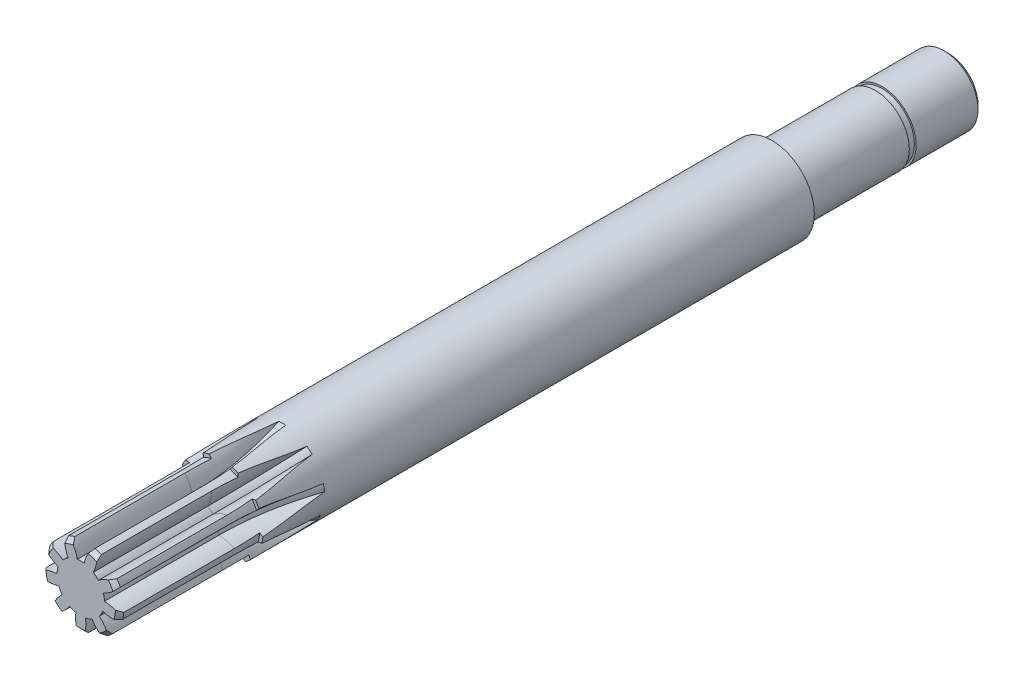
from build123d import *

# Parameters (mm, degrees)
R_P_TITION_CIRCULAIRE1_COUNT = 9


with BuildPart() as part:
    # Esquisse1 → Révolution1 (revolve)
    with BuildSketch(Plane(origin=(0, 0, 0), x_dir=(0, 0, -1), z_dir=(1, 0, 0))):
        Polygon((0, 5), (0, 4), (12.2, 4), (12.2, 3.8), (13, 3.8), (13, 4), (20.3, 4), (20.8, 3.5), (20.8, 0), (-81.5, 0), (-81.5, 4.1), (-81, 4.6), (-65, 4.6), (-65, 5), align=None)
    revolve(axis=Axis((0, 0, 153.012761233), (0, 0, -1)))

    # Enlèvement de matière-Balayage1: sweep along a path in Esquisse2
    with BuildLine(Plane(origin=(0, 0, 0), x_dir=(0, 0, -1), z_dir=(1, 0, 0))) as enl_vement_de_mati_re_balayage1_path:
        Line((-81.5, 2.8), (-68, 2.8))
        ThreePointArc((-68, 2.8), (-58.513167019, 4.669932988), (-50.445513394, 10))
    # Esquisse3 → Enlèvement de matière-Balayage1 (sweep, cut)
    with BuildSketch(Plane.XY.offset(81.5)):
        with BuildLine():
            Line((-2, 6), (2, 6))
            Line((2, 6), (2, 5.189812468))
            ThreePointArc((2, 5.189812468), (0.972712422, 4.130790979), (0.399230677, 2.771392225))
            ThreePointArc((0.399230677, 2.771392225), (0, 2.8), (-0.399230677, 2.771392225))
            ThreePointArc((-0.399230677, 2.771392225), (-0.972712422, 4.130790979), (-2, 5.189812468))
            Line((-2, 5.189812468), (-2, 6))
        make_face()
    enl_vement_de_mati_re_balayage1 = sweep(path=enl_vement_de_mati_re_balayage1_path.line, mode=Mode.SUBTRACT)

    # Répétition circulaire1: Enlèvement de matière-Balayage1 ×9 about axis
    r_p_tition_circulaire1_axis = Axis((0, 0, 0), (0, 0, 1))
    for i in range(1, R_P_TITION_CIRCULAIRE1_COUNT):
        add(enl_vement_de_mati_re_balayage1.rotate(r_p_tition_circulaire1_axis, i * 360 / R_P_TITION_CIRCULAIRE1_COUNT), mode=Mode.SUBTRACT)


solid = part.part
